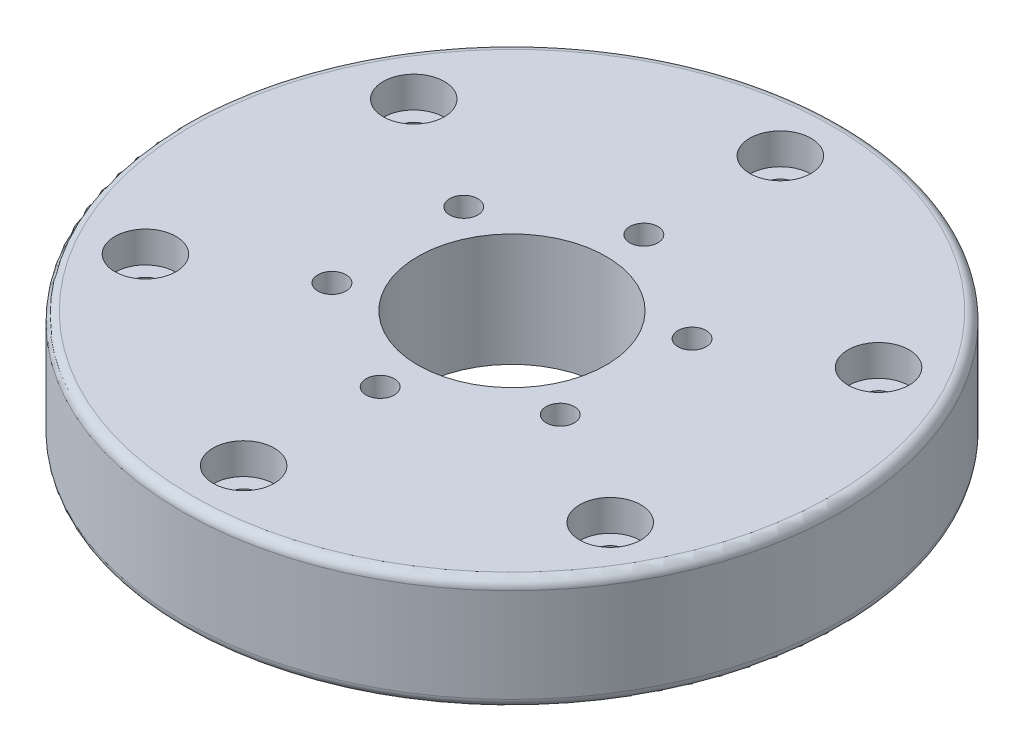
from build123d import *

# Parameters (mm, degrees)
SKETCH_1_R               = 35
EXTRUDE_1_DEPTH          = 12
HOLE_WIZARD_1_D          = 6.5
HOLE_WIZARD_1_DEPTH      = 3.3
PATTERN_CIRCULAR_1_COUNT = 6
HOLE_WIZARD_2_D          = 3.3
PATTERN_CIRCULAR_2_COUNT = 6
HOLE_WIZARD_3_D          = 3
PATTERN_CIRCULAR_3_COUNT = 6
FILLET_1_R               = 1
HOLE_WIZARD_4_D          = 20


with BuildPart() as part:
    # 草图1 → 凸台-拉伸1 (new body)
    with BuildSketch(Plane(origin=(0, 0, 0), x_dir=(1, 0, 0), z_dir=(0, 1, 0))):
        with Locations(Location((0, 0, 0), (0, 0, 270))):
            Circle(SKETCH_1_R)
    extrude(amount=EXTRUDE_1_DEPTH)

    # 孔1
    with Locations(Plane(origin=(0, 12, 0), x_dir=(1, 0, 0), z_dir=(0, 1, 0))):
        with Locations((0, 28.5)):
            hole_wizard_1 = Hole(HOLE_WIZARD_1_D / 2, depth=HOLE_WIZARD_1_DEPTH)

    # 阵列(圆周)1: 孔1 ×6 about axis
    pattern_circular_1_axis = Axis((0, 0, 0), (0, 1, 0))
    for i in range(1, PATTERN_CIRCULAR_1_COUNT):
        add(hole_wizard_1.rotate(pattern_circular_1_axis, i * 360 / PATTERN_CIRCULAR_1_COUNT), mode=Mode.SUBTRACT)

    # 孔2 (through all)
    with Locations(Plane(origin=(0, 8.7, 0), x_dir=(1, 0, 0), z_dir=(0, 1, 0))):
        with Locations((0, 28.5)):
            hole_wizard_2 = Hole(HOLE_WIZARD_2_D / 2)

    # 阵列(圆周)2: 孔2 ×6 about axis
    pattern_circular_2_axis = Axis((0, 0, 0), (0, 1, 0))
    for i in range(1, PATTERN_CIRCULAR_2_COUNT):
        add(hole_wizard_2.rotate(pattern_circular_2_axis, i * 360 / PATTERN_CIRCULAR_2_COUNT), mode=Mode.SUBTRACT)

    # 孔3 (through all)
    with Locations(Plane(origin=(0, 12, 0), x_dir=(1, 0, 0), z_dir=(0, 1, 0))):
        with Locations((0, 14)):
            hole_wizard_3 = Hole(HOLE_WIZARD_3_D / 2)

    # 阵列(圆周)3: 孔3 ×6 about axis
    pattern_circular_3_axis = Axis((0, 0, 0), (0, 1, 0))
    for i in range(1, PATTERN_CIRCULAR_3_COUNT):
        add(hole_wizard_3.rotate(pattern_circular_3_axis, i * 360 / PATTERN_CIRCULAR_3_COUNT), mode=Mode.SUBTRACT)

    # 圆角1
    fillet_1_edges = [part.edges().sort_by_distance(p)[0] for p in [
        (0, 0, -35),
        (0, 12, -35),
    ]]
    fillet(fillet_1_edges, radius=FILLET_1_R)

    # 孔4 (through all)
    with Locations(Plane(origin=(0, 12, 0), x_dir=(1, 0, 0), z_dir=(0, 1, 0))):
        with Locations((0, 0)):
            Hole(HOLE_WIZARD_4_D / 2)


solid = part.part
